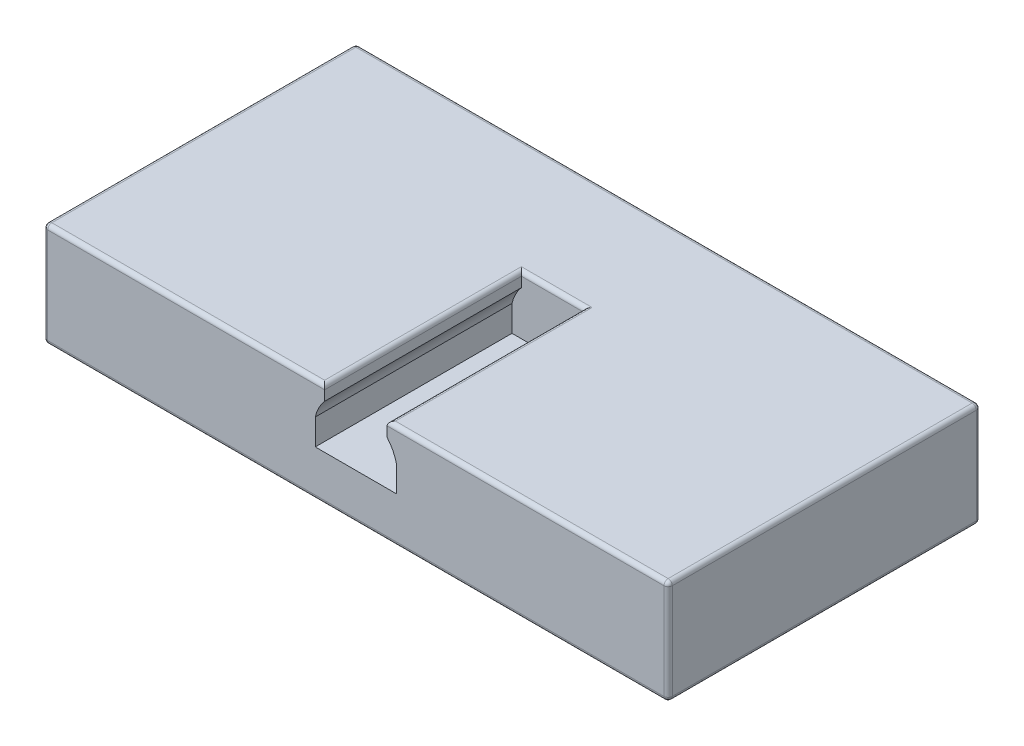
from build123d import *

# Parameters (mm, degrees)
SKETCH_1_W          = 30
SKETCH_1_H          = 15
EXTRUDE_1_DEPTH     = 5
CUT_EXTRUDE_1_DEPTH = 9.45
CUT_EXTRUDE_2_DEPTH = 9.45
FILLET_1_R          = 0.2


with BuildPart() as part:
    # 草图1 → 凸台-拉伸1 (new body)
    with BuildSketch(Plane(origin=(0, 0, 0), x_dir=(1, 0, 0), z_dir=(0, 1, 0))):
        with Locations((0, 7.5)):
            Rectangle(SKETCH_1_W, SKETCH_1_H)
    extrude(amount=EXTRUDE_1_DEPTH)

    # 草图2 → 切除-拉伸1 (cut)
    with BuildSketch(Plane.XY):
        with BuildLine():
            Line((-1.5, 5), (-1.5, 4.322875656))
            ThreePointArc((-1.5, 4.322875656), (-1.780042303, 3.911838473), (-1.95, 3.444409721))
            Line((-1.95, 3.444409721), (-1.95, 2.2))
            Line((-1.95, 2.2), (1.95, 2.2))
            Line((1.95, 2.2), (1.95, 3.444409721))
            ThreePointArc((1.95, 3.444409721), (1.780042303, 3.911838473), (1.5, 4.322875656))
            Line((1.5, 4.322875656), (1.5, 5))
            Line((1.5, 5), (-1.5, 5))
        make_face()
    extrude(amount=-CUT_EXTRUDE_1_DEPTH, mode=Mode.SUBTRACT)

    # 草图3 → 切除-拉伸2 (cut)
    with BuildSketch(Plane(origin=(0, 0, -15), x_dir=(-1, 0, 0), z_dir=(0, 0, -1))):
        with BuildLine():
            Line((-9, 0), (-9, 0.677124344))
            ThreePointArc((-9, 0.677124344), (-9.280042303, 1.088161527), (-9.45, 1.555590279))
            Line((-9.45, 1.555590279), (-9.45, 2.8))
            Line((-9.45, 2.8), (-5.55, 2.8))
            Line((-5.55, 2.8), (-5.55, 1.555590279))
            ThreePointArc((-5.55, 1.555590279), (-5.719957697, 1.088161527), (-6, 0.677124344))
            Line((-6, 0.677124344), (-6, 0))
            Line((-6, 0), (-9, 0))
        make_face()
        with BuildLine():
            Line((9, 0), (6, 0))
            Line((6, 0), (6, 0.677124344))
            ThreePointArc((6, 0.677124344), (5.719957697, 1.088161527), (5.55, 1.555590279))
            Line((5.55, 1.555590279), (5.55, 2.8))
            Line((5.55, 2.8), (9.45, 2.8))
            Line((9.45, 2.8), (9.45, 1.555590279))
            ThreePointArc((9.45, 1.555590279), (9.280042303, 1.088161527), (9, 0.677124344))
            Line((9, 0.677124344), (9, 0))
        make_face()
    extrude(amount=-CUT_EXTRUDE_2_DEPTH, mode=Mode.SUBTRACT)

    # 圆角1
    fillet_1_edges = [part.edges().sort_by_distance(p)[0] for p in [
        (15, 5, -7.5),
        (0, 5, -15),
        (8.25, 5, 0),
        (0, 5, -9.45),
        (-1.5, 5, -4.725),
        (1.5, 5, -4.725),
        (0, 0, -15),
        (-15, 5, -7.5),
        (7.5, 0, -5.55),
        (6, 0, -10.275),
        (9, 0, -10.275),
        (12, 0, -15),
        (15, 0, -7.5),
        (0, 0, 0),
        (-15, 0, -7.5),
        (-12, 0, -15),
        (-7.5, 0, -5.55),
        (-9, 0, -10.275),
        (-6, 0, -10.275),
        (-8.25, 5, 0),
        (-15, 2.5, -15),
        (15, 2.5, -15),
        (15, 2.5, 0),
        (-15, 2.5, 0),
    ]]
    fillet(fillet_1_edges, radius=FILLET_1_R)


solid = part.part
